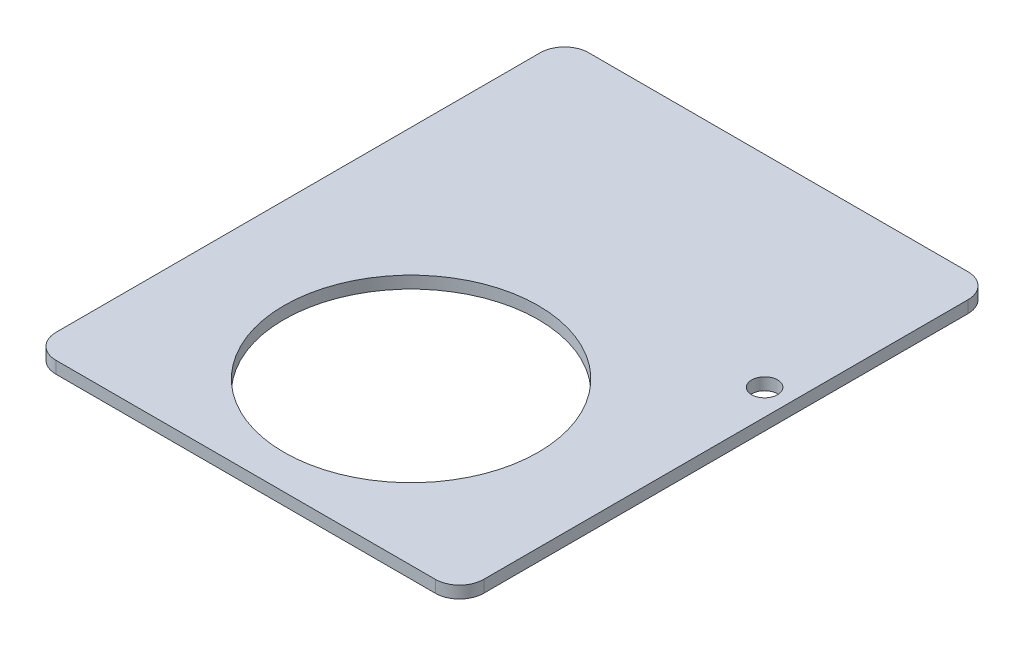
from build123d import *

# Parameters (mm, degrees)
SKETCH1_R           = 15.75
SKETCH1_R_2         = 1.6
BOSS_EXTRUDE2_DEPTH = 1.5


with BuildPart() as part:
    # Sketch1 → Boss-Extrude2 (new body)
    with BuildSketch(Plane(origin=(0, 0, 0), x_dir=(1, 0, 0), z_dir=(0, 1, 0))):
        with BuildLine():
            Line((-17.890919225, 47.151235704), (29.109080775, 47.151235704))
            ThreePointArc((29.109080775, 47.151235704), (31.230401119, 46.272556047), (32.109080775, 44.151235704))
            Line((32.109080775, 44.151235704), (32.109080775, -15.848764296))
            ThreePointArc((32.109080775, -15.848764296), (31.230401119, -17.97008464), (29.109080775, -18.848764296))
            Line((29.109080775, -18.848764296), (-17.890919225, -18.848764296))
            ThreePointArc((-17.890919225, -18.848764296), (-20.012239568, -17.97008464), (-20.890919225, -15.848764296))
            Line((-20.890919225, -15.848764296), (-20.890919225, 44.151235704))
            ThreePointArc((-20.890919225, 44.151235704), (-20.012239568, 46.272556047), (-17.890919225, 47.151235704))
        make_face()
        with Locations(Location((6.109080775, 1.151235704, 0), (0, 0, 270))):
            Circle(SKETCH1_R, mode=Mode.SUBTRACT)
        with Locations(Location((28.909080775, 22.151235704, 0), (0, 0, 270))):
            Circle(SKETCH1_R_2, mode=Mode.SUBTRACT)
    extrude(amount=BOSS_EXTRUDE2_DEPTH)


solid = part.part
